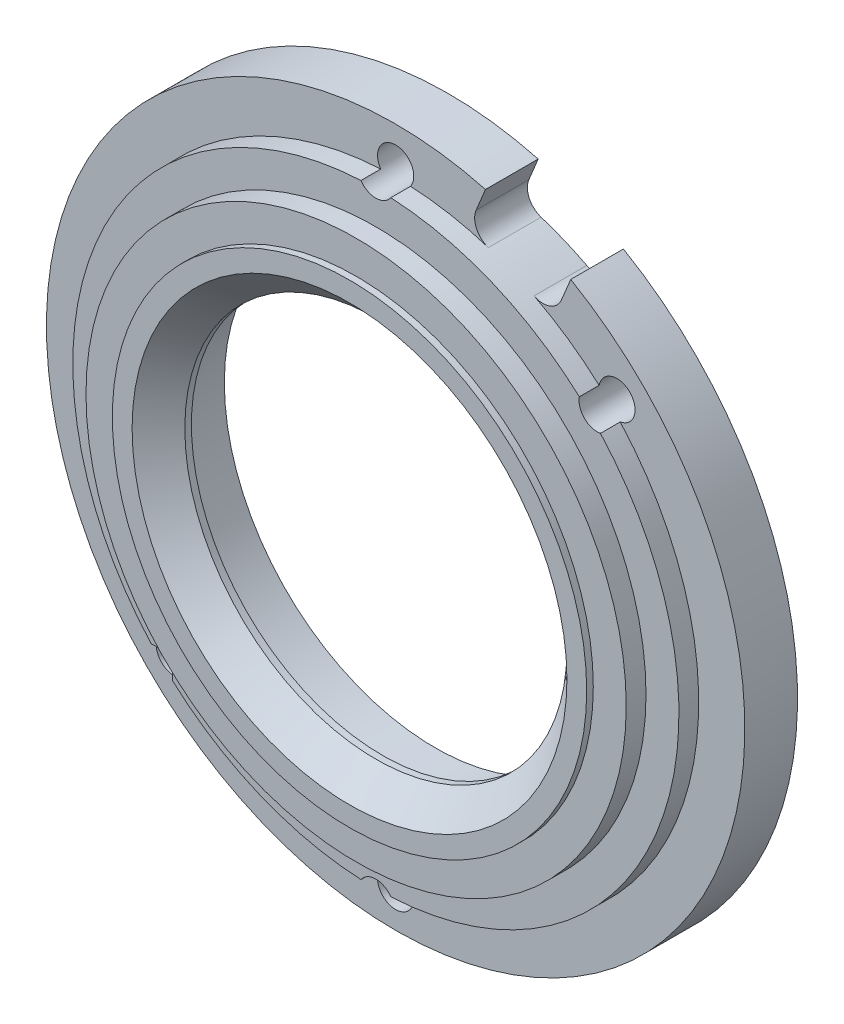
from build123d import *

# Parameters (mm, degrees)
CHAMFER1_SIZE      = 4
SKETCH5_R          = 2.75
CUT_EXTRUDE4_DEPTH = 20
CUT_EXTRUDE5_DEPTH = 76.37904218
FILLET2_R          = 3
SKETCH7_R          = 42.25
CUT_EXTRUDE6_DEPTH = 2
SKETCH8_R          = 42.25
SKETCH8_R_2        = 40.25
CUT_EXTRUDE7_DEPTH = 4


with BuildPart() as part:
    # Sketch1 → Revolve1 (revolve)
    with BuildSketch(Plane(origin=(0, 0, 0), x_dir=(0, 0, -1), z_dir=(1, 0, 0)), mode=Mode.PRIVATE) as revolve1_sk:
        Polygon((5, 29), (5, 32), (15, 32), (15, 53), (7, 53), (7, 46), (4, 46), (4, 41), (1, 41), (1, 36), (0, 36), (0, 29), align=None)
    revolve(revolve1_sk.sketch.rotate(Axis((0, 0, 0), (0, 0, -1)), 90), axis=Axis((0, 0, 0), (0, 0, -1)))

    # Chamfer1
    chamfer1_edges = [part.edges().sort_by_distance(p)[0] for p in [
        (-29, 0, 0),
    ]]
    chamfer(chamfer1_edges, length=CHAMFER1_SIZE)

    # Sketch5 → Cut-Extrude4 (cut)
    with BuildSketch(Plane(origin=(0, 0, -15), x_dir=(-1, 0, 0), z_dir=(0, 0, -1))):
        with Locations((0, 47.5)):
            Circle(SKETCH5_R)
        with Locations((33.587572106, -33.587572106)):
            Circle(SKETCH5_R)
        with Locations((0, -47.5)):
            Circle(SKETCH5_R)
        with Locations((-33.587572106, 33.587572106)):
            Circle(SKETCH5_R)
    extrude(amount=-CUT_EXTRUDE4_DEPTH, mode=Mode.SUBTRACT)

    # Sketch6 → Cut-Extrude5 (cut, through all)
    with BuildSketch(Plane.XY.offset(-7)):
        with BuildLine():
            Line((26.571699547, 45.857875912), (23.865580267, 39.324726045))
            ThreePointArc((23.865580267, 39.324726045), (17.603437889, 42.498458496), (10.931266811, 44.682294098))
            Line((10.931266811, 44.682294098), (13.637386091, 51.215443966))
            ThreePointArc((13.637386091, 51.215443966), (20.282221915, 48.965615223), (26.571699547, 45.857875912))
        make_face()
    extrude(amount=-CUT_EXTRUDE5_DEPTH, mode=Mode.SUBTRACT)

    # Fillet2
    fillet2_edges = [part.edges().sort_by_distance(p)[0] for p in [
        (23.865580267, 39.324726045, -11),
        (10.931266811, 44.682294098, -11),
    ]]
    fillet(fillet2_edges, radius=FILLET2_R)

    # Sketch7 → Cut-Extrude6 (cut)
    with BuildSketch(Plane(origin=(0, 0, -15), x_dir=(-1, 0, 0), z_dir=(0, 0, -1))):
        Circle(SKETCH7_R)
    extrude(amount=-CUT_EXTRUDE6_DEPTH, mode=Mode.SUBTRACT)

    # Sketch8 → Cut-Extrude7 (cut)
    with BuildSketch(Plane(origin=(0, 0, -13), x_dir=(-1, 0, 0), z_dir=(0, 0, -1))):
        Circle(SKETCH8_R)
        Circle(SKETCH8_R_2, mode=Mode.SUBTRACT)
    extrude(amount=-CUT_EXTRUDE7_DEPTH, mode=Mode.SUBTRACT)


solid = part.part
